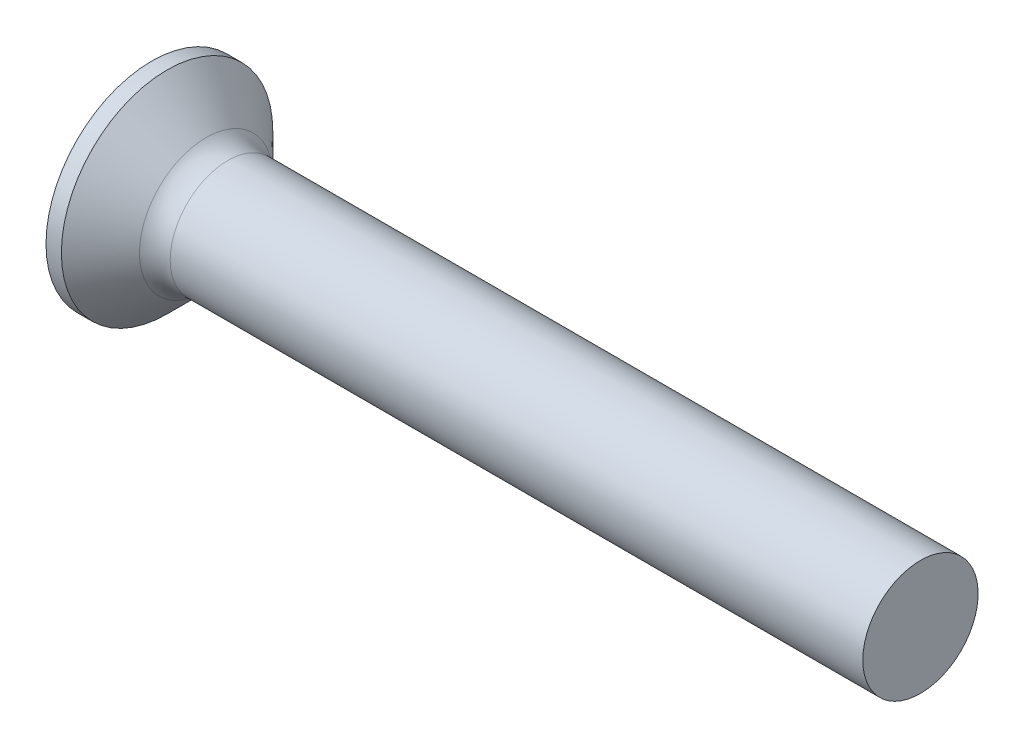
from build123d import *

# Parameters (mm, degrees)
FILLET1_R    = 0.8
RECPAT_COUNT = 2
RECPAT_ANGLE = 90


with BuildPart() as part:
    # BodySke → Base-Revolve (revolve)
    with BuildSketch(Plane.XY, mode=Mode.PRIVATE) as base_revolve_sk:
        Polygon((0, 0), (0, 2.75), (0.4, 2.75), (1.65, 1.5), (20, 1.5), (20, 0), align=None)
    revolve(base_revolve_sk.sketch.rotate(Axis((-6.35, 0, 0), (1, 0, 0)), 90), axis=Axis((-6.35, 0, 0), (1, 0, 0)))

    # Fillet1
    fillet1_edges = [part.edges().sort_by_distance(p)[0] for p in [
        (1.65, 0, -1.5),
    ]]
    fillet(fillet1_edges, radius=FILLET1_R)

    # Sketch3 → Recess section 0
    with BuildSketch(Plane.ZY):
        with BuildLine():
            Line((-0.37, 1.5), (0.37, 1.5))
            Line((0.37, 1.5), (0.37, -1.5))
            Line((0.37, -1.5), (-0.37, -1.5))
            Line((-0.37, -1.5), (-0.37, 1.5))
        make_face()
    # Sketch4 → Recess section 1
    with BuildSketch(Plane.ZY.offset(-2.01)):
        with BuildLine():
            Line((-0.37, 0.497851135), (0.37, 0.497851135))
            Line((0.37, 0.497851135), (0.37, -0.497851135))
            Line((0.37, -0.497851135), (-0.37, -0.497851135))
            Line((-0.37, -0.497851135), (-0.37, 0.497851135))
        make_face()
    recess = loft(mode=Mode.SUBTRACT)

    # RecPat: Recess ×2 about axis
    recpat_axis = Axis((0, 0, 0), (1, 0, 0))
    for i in range(1, RECPAT_COUNT):
        add(recess.rotate(recpat_axis, i * RECPAT_ANGLE / (RECPAT_COUNT - 1)), mode=Mode.SUBTRACT)

    # RecCorSke → RecessCore (revolve, cut)
    with BuildSketch(Plane.XY, mode=Mode.PRIVATE) as recesscore_sk:
        Polygon((0, 0), (0, 0.696552892), (2.01, 0.556), (2.190655351, 0), align=None)
    revolve(recesscore_sk.sketch.rotate(Axis((-3.175, 0, 0), (1, 0, 0)), 90), axis=Axis((-3.175, 0, 0), (1, 0, 0)), mode=Mode.SUBTRACT)


solid = part.part
